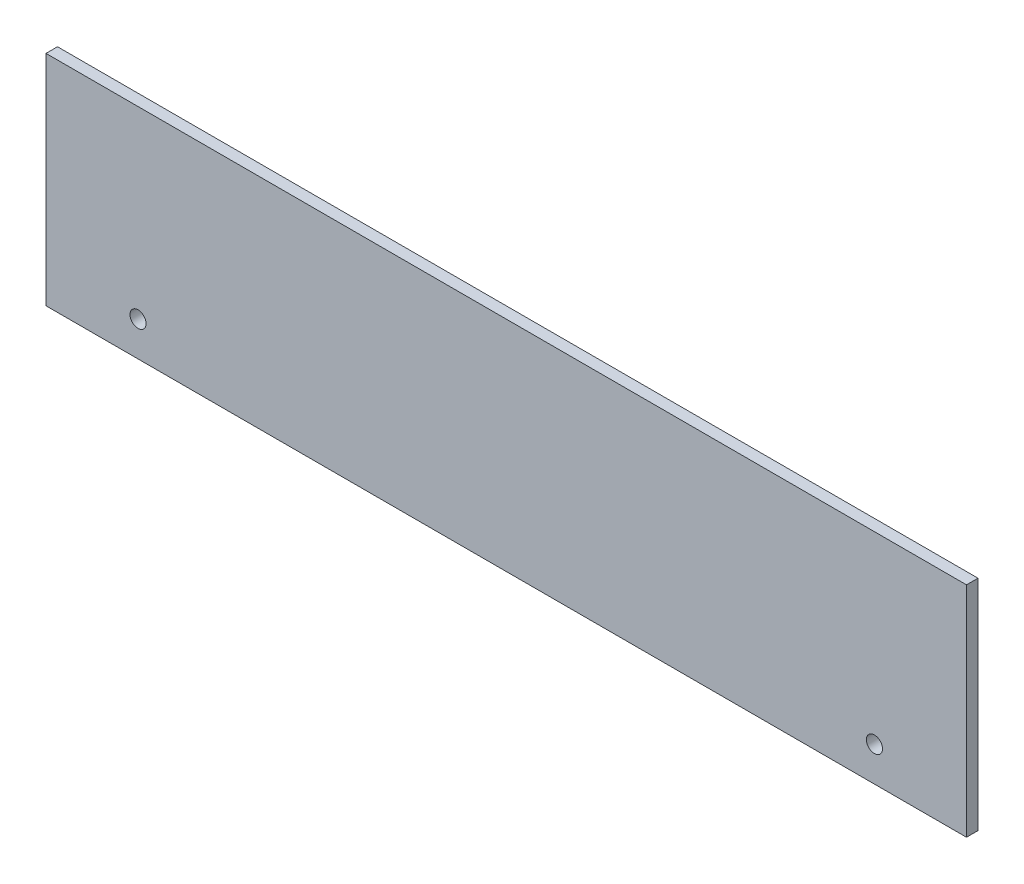
from build123d import *

# Parameters (mm, degrees)
SKETCH_1_R      = 3.5
EXTRUDE_1_DEPTH = 5


with BuildPart() as part:
    # 草图1 → 凸台-拉伸1 (new body)
    with BuildSketch(Plane.XY):
        Polygon((-226.105641951, -107.952440937), (173.894358049, -107.952440937), (173.894358049, -202.952440937), (121.394358049, -202.952440937), (1.394358049, -202.952440937), (-53.605641951, -202.952440937), (-226.105641951, -202.952440937), align=None)
        with Locations((-186.105641951, -187.952440937)):
            Circle(SKETCH_1_R, mode=Mode.SUBTRACT)
        with Locations(Location((133.894358049, -187.952440937, 0), (0, 0, 180))):
            Circle(SKETCH_1_R, mode=Mode.SUBTRACT)
    extrude(amount=EXTRUDE_1_DEPTH)


solid = part.part
